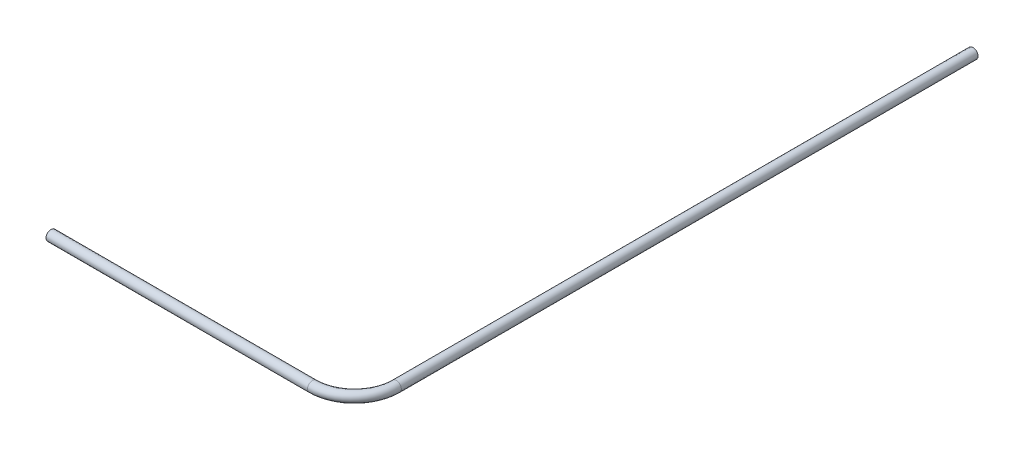
from build123d import *

# Parameters (mm, degrees)
SKETCH_2_R = 6


with BuildPart() as part:
    # По траектории1: sweep along a path in Эскиз1
    with BuildLine(Plane(origin=(0, 0, 0), x_dir=(1, 0, 0), z_dir=(0, 1, 0))) as sweep_1_path:
        Line((12, 0), (12, -688))
        ThreePointArc((12, -688), (-2.644660941, -723.355339059), (-38, -738))
        Line((-38, -738), (-350, -738))
    # Эскиз2 → По траектории1 (sweep)
    with BuildSketch(Plane.XY):
        with Locations((12, 0)):
            Circle(SKETCH_2_R)
    sweep(path=sweep_1_path.line)


solid = part.part
